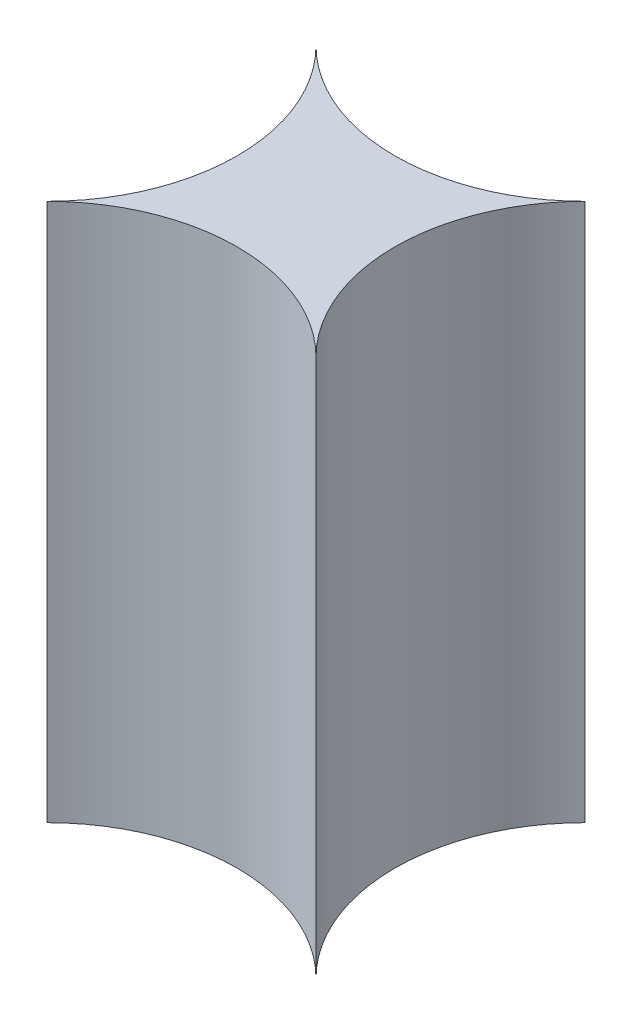
from build123d import *

# Parameters (mm, degrees)
BOSS_EXTRUDE1_DEPTH = 10


with BuildPart() as part:
    # Sketch1 → Boss-Extrude1 (new body)
    with BuildSketch(Plane(origin=(0, 0, 0), x_dir=(1, 0, 0), z_dir=(0, 1, 0))):
        with BuildLine():
            ThreePointArc((-2.5, 2.5), (-1.464466094, 0), (-2.5, -2.5))
            ThreePointArc((-2.5, -2.5), (0, -1.464466094), (2.5, -2.5))
            ThreePointArc((2.5, -2.5), (1.464466094, 0), (2.5, 2.5))
            ThreePointArc((2.5, 2.5), (0, 1.464466094), (-2.5, 2.5))
        make_face()
    extrude(amount=BOSS_EXTRUDE1_DEPTH)


solid = part.part
